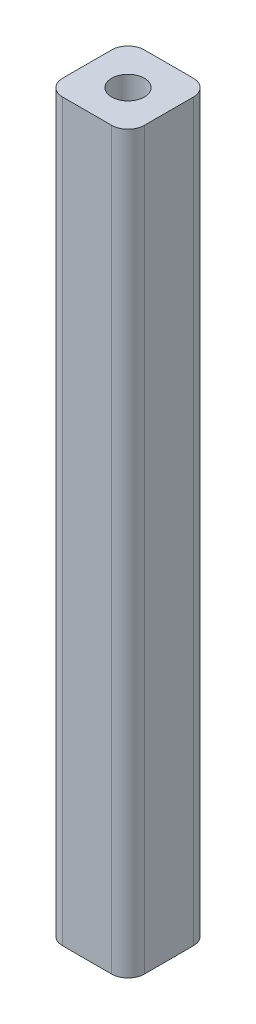
from build123d import *

# Parameters (mm, degrees)
SKETCH_1_W          = 10
SKETCH_1_H          = 10
EXTRUDE_1_DEPTH     = 90
SKETCH_2_R          = 2
CUT_EXTRUDE_1_DEPTH = 10
CUT_EXTRUDE_START   = -10
SKETCH_4_R          = 2
CUT_EXTRUDE_2_DEPTH = 10
FILLET_1_R          = 2


with BuildPart() as part:
    # 草图1 → 凸台-拉伸1 (new body)
    with BuildSketch(Plane(origin=(0, 0, 0), x_dir=(1, 0, 0), z_dir=(0, 1, 0))):
        Rectangle(SKETCH_1_W, SKETCH_1_H)
    extrude(amount=EXTRUDE_1_DEPTH)

    # 草图2 → 切除-拉伸1 (cut)
    with BuildSketch(Plane(origin=(0, 90, 0), x_dir=(1, 0, 0), z_dir=(0, 1, 0))):
        with Locations(Location((0, 0, 0), (0, 0, 270))):
            Circle(SKETCH_2_R)
    extrude(amount=-CUT_EXTRUDE_1_DEPTH, mode=Mode.SUBTRACT)

    # 草图4 → 切除-拉伸2 (cut)
    with BuildSketch(Plane.XZ.offset(CUT_EXTRUDE_START)):
        with Locations(Location((0, 0, 0), (0, 0, 90))):
            Circle(SKETCH_4_R)
    extrude(amount=CUT_EXTRUDE_2_DEPTH, mode=Mode.SUBTRACT)

    # 圆角1
    fillet_1_edges = [part.edges().sort_by_distance(p)[0] for p in [
        (-5, 45, -5),
        (5, 45, -5),
        (5, 45, 5),
        (-5, 45, 5),
    ]]
    fillet(fillet_1_edges, radius=FILLET_1_R)


solid = part.part
